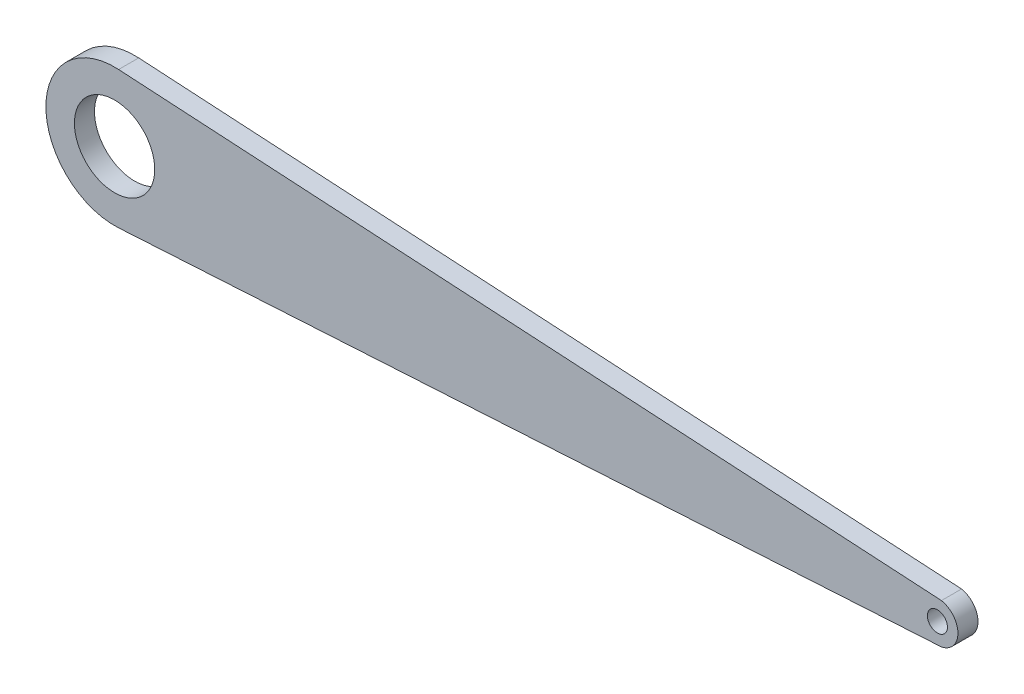
from build123d import *

# Parameters (mm, degrees)
ESBO_O1_R                = 10
ESBO_O1_R_2              = 2.5
RESSALTO_EXTRUS_O1_DEPTH = 5


with BuildPart() as part:
    # Esboço1 → Ressalto-extrusão1 (new body)
    with BuildSketch(Plane.XY):
        with BuildLine():
            Line((-102.4, -17.070121396), (102.4, -5))
            ThreePointArc((102.4, -5), (106.494161828, 0), (102.4, 5))
            Line((102.4, 5), (-102.4, 17.070121396))
            ThreePointArc((-102.4, 17.070121396), (-120.50578902, 0), (-102.4, -17.070121396))
        make_face()
        with Locations((-103.406047058, 0)):
            Circle(ESBO_O1_R, mode=Mode.SUBTRACT)
        with Locations((101.393952942, 0)):
            Circle(ESBO_O1_R_2, mode=Mode.SUBTRACT)
    extrude(amount=RESSALTO_EXTRUS_O1_DEPTH)


solid = part.part
